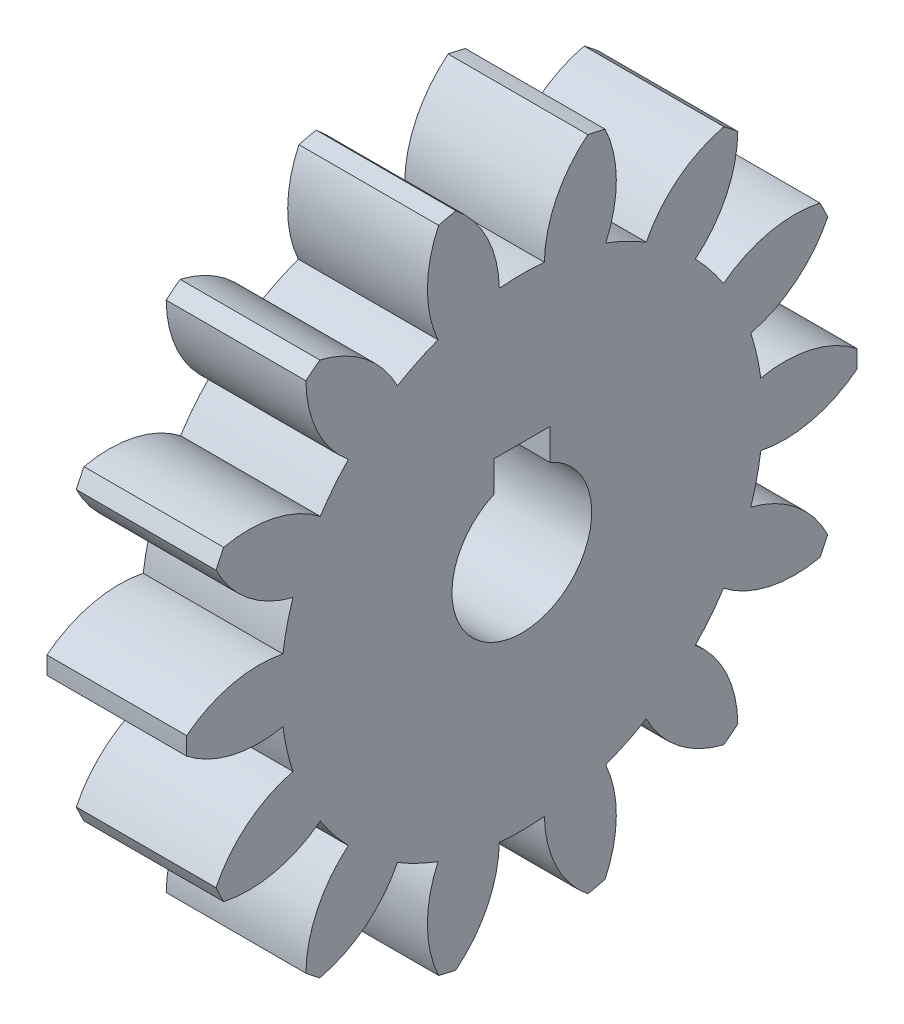
from build123d import *

# Parameters (mm, degrees)
BASPROSKE_W     = 10
BASPROSKE_H     = 24
TOOTHCUT_DEPTH  = 36.383612026
TEETHCUTS_COUNT = 14
TEETHCUTS_ANGLE = 334.285714286
BORSKE_R        = 5
BORE_DEPTH      = 50.0000508
KEYSKE_W        = 4
KEYSKE_H        = 6.8
KEYWAY_DEPTH    = 50.0000508


with BuildPart() as part:
    # BasProSke → Base-Revolve (revolve)
    with BuildSketch(Plane(origin=(0, 0, 0), x_dir=(1, 0, 0), z_dir=(0, 1, 0)), mode=Mode.PRIVATE) as base_revolve_sk:
        with Locations((5, 12)):
            Rectangle(BASPROSKE_W, BASPROSKE_H)
    revolve(base_revolve_sk.sketch.rotate(Axis((-10, 0, 0), (1, 0, 0)), 180), axis=Axis((-10, 0, 0), (1, 0, 0)))

    # TooCutSke → ToothCut (cut, through all)
    with BuildSketch(Plane(origin=(0, 0, 0), x_dir=(0, 0, -1), z_dir=(1, 0, 0))):
        with BuildLine():
            ThreePointArc((1.61114962, 17.173590128), (0, 17.249), (-1.61114962, 17.173590128))
            ThreePointArc((-1.61114962, 17.173590128), (-2.470269362, 20.710630663), (-4.744995334, 23.552173242))
            ThreePointArc((-4.744995334, 23.552173242), (0, 24.0254), (4.744995334, 23.552173242))
            ThreePointArc((4.744995334, 23.552173242), (2.470269362, 20.710630663), (1.61114962, 17.173590128))
        make_face()
    toothcut = extrude(amount=TOOTHCUT_DEPTH, mode=Mode.SUBTRACT)

    # TeethCuts: ToothCut ×14 about axis
    teethcuts_axis = Axis((-10, 0, 0), (1, 0, 0))
    for i in range(1, TEETHCUTS_COUNT):
        add(toothcut.rotate(teethcuts_axis, i * TEETHCUTS_ANGLE / (TEETHCUTS_COUNT - 1)), mode=Mode.SUBTRACT)

    # BorSke → Bore (cut, symmetric)
    with BuildSketch(Plane(origin=(0, 0, 0), x_dir=(0, 0, -1), z_dir=(1, 0, 0))):
        with Locations(Location((0, 0, 0), (0, 0, 180))):
            Circle(BORSKE_R)
    extrude(amount=BORE_DEPTH, both=True, mode=Mode.SUBTRACT)

    # KeySke → Keyway (cut, symmetric)
    with BuildSketch(Plane(origin=(0, 0, 0), x_dir=(0, 0, -1), z_dir=(1, 0, 0))):
        with Locations((0, 3.4)):
            Rectangle(KEYSKE_W, KEYSKE_H)
    extrude(amount=KEYWAY_DEPTH, both=True, mode=Mode.SUBTRACT)


solid = part.part
